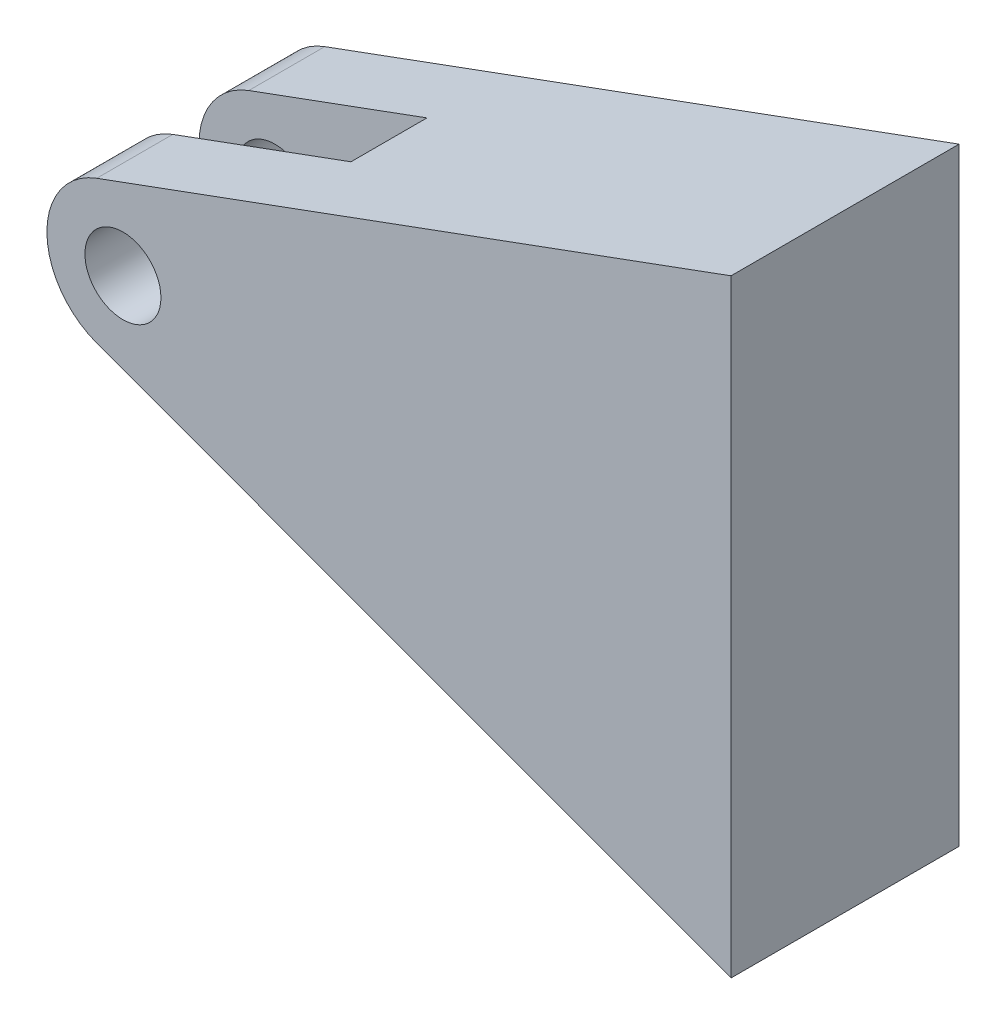
from build123d import *

# Parameters (mm, degrees)
SKETCH1_R           = 2.5
BOSS_EXTRUDE1_DEPTH = 15
CUT_EXTRUDE1_START  = -30
SKETCH2_W           = 5
SKETCH2_H           = 40
CUT_EXTRUDE1_DEPTH  = 22.478150705


with BuildPart() as part:
    # Sketch1 → Boss-Extrude1 (new body)
    with BuildSketch(Plane.XY):
        with BuildLine():
            Line((40, 20), (-1.722048604, 4.694097209))
            ThreePointArc((-1.722048604, 4.694097209), (-5, 0), (-1.722048604, -4.694097209))
            Line((-1.722048604, -4.694097209), (40, -20))
            Line((40, -20), (40, 0))
            Line((40, 0), (40, 20))
        make_face()
        Circle(SKETCH1_R, mode=Mode.SUBTRACT)
    extrude(amount=BOSS_EXTRUDE1_DEPTH)

    # Sketch2 → Cut-Extrude1 (cut, through all)
    with BuildSketch(Plane(origin=(40, 0, 0), x_dir=(0, 0, -1), z_dir=(1, 0, 0)).offset(CUT_EXTRUDE1_START)):
        with Locations((-7.5, 0)):
            Rectangle(SKETCH2_W, SKETCH2_H)
    extrude(amount=-CUT_EXTRUDE1_DEPTH, mode=Mode.SUBTRACT)


solid = part.part
